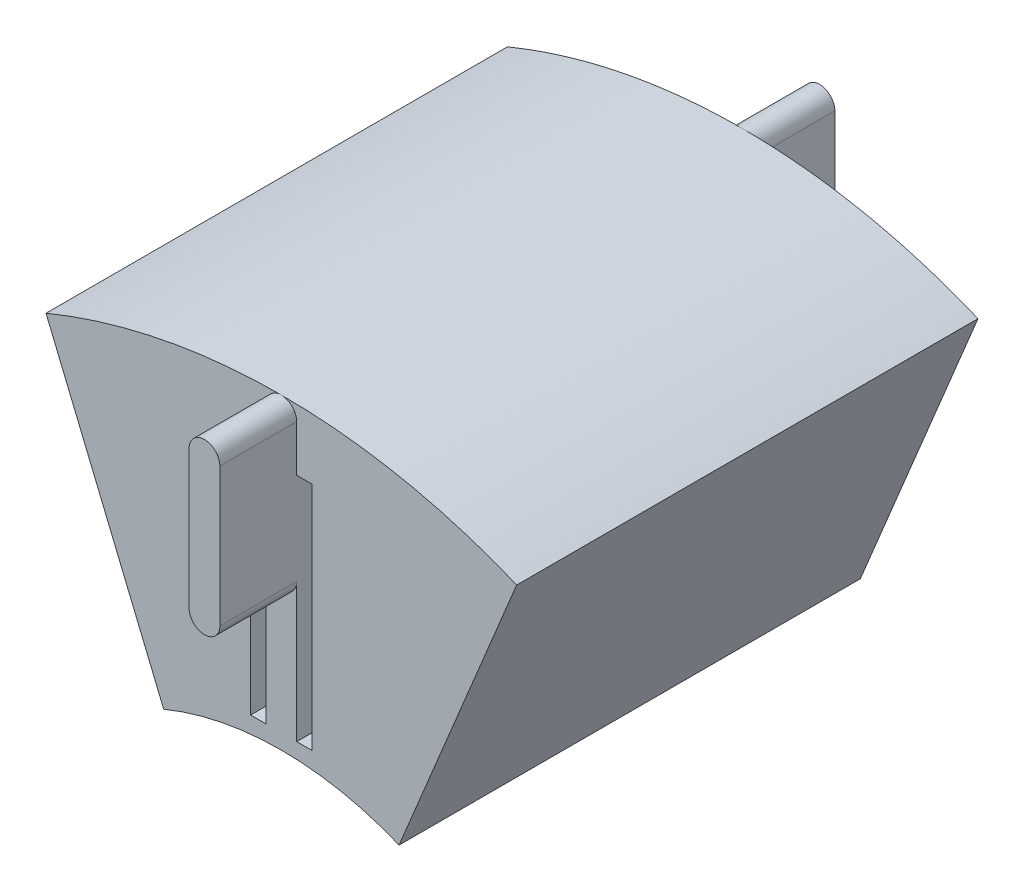
from build123d import *

# Parameters (mm, degrees)
BOSS_EXTRUDE1_DEPTH     = 3
BOSS_EXTRUDE2_DEPTH     = 0.5
BOSS_EXTRUDE3_START     = 0.5
BOSS_EXTRUDE3_DEPTH     = 0.5
CUT_EXTRUDE2_DEPTH      = 0.1
CUT_EXTRUDE2_DEPTH_BACK = 0.3
SKETCH9_W               = 0.2
SKETCH9_H               = 1.5
BOSS_EXTRUDE5_DEPTH     = 3


with BuildPart() as part:
    # Sketch1 → Boss-Extrude1 (new body)
    with BuildSketch(Plane.XY):
        with BuildLine():
            Line((-1.530733729, 3.69551813), (-0.765366865, 1.847759065))
            ThreePointArc((-0.765366865, 1.847759065), (0, 2), (0.765366865, 1.847759065))
            Line((0.765366865, 1.847759065), (1.530733729, 3.69551813))
            ThreePointArc((1.530733729, 3.69551813), (0, 4), (-1.530733729, 3.69551813))
        make_face()
    extrude(amount=BOSS_EXTRUDE1_DEPTH)

    # Sketch2 → Boss-Extrude2 (add)
    with BuildSketch(Plane.XY.offset(3)):
        with BuildLine():
            Line((-0.1, 3), (-0.1, 3.9))
            ThreePointArc((-0.1, 3.9), (0, 4), (0.1, 3.9))
            Line((0.1, 3.9), (0.1, 3))
            ThreePointArc((0.1, 3), (0, 2.9), (-0.1, 3))
        make_face()
    extrude(amount=BOSS_EXTRUDE2_DEPTH)

    # Sketch3 → Boss-Extrude3 (add)
    with BuildSketch(Plane(origin=(0, 0, 0), x_dir=(-1, 0, 0), z_dir=(0, 0, -1)).offset(BOSS_EXTRUDE3_START)):
        with BuildLine():
            Line((-0.1, 3), (-0.1, 3.9))
            ThreePointArc((-0.1, 3.9), (0, 4), (0.1, 3.9))
            Line((0.1, 3.9), (0.1, 3))
            ThreePointArc((0.1, 3), (0, 2.9), (-0.1, 3))
        make_face()
    extrude(amount=-BOSS_EXTRUDE3_DEPTH)

    # Sketch5 → Cut-Extrude2 (cut, two sides: drawn at the far end of the back side and taken through both)
    with BuildSketch(Plane(origin=(0.1, 0, 0), x_dir=(0, 0, -1), z_dir=(1, 0, 0)).offset(-CUT_EXTRUDE2_DEPTH_BACK)):
        Polygon((-3, 3.597759065), (-3, 2.097759065), (-1, 2.097759065), align=None)
    extrude(amount=CUT_EXTRUDE2_DEPTH + CUT_EXTRUDE2_DEPTH_BACK, mode=Mode.SUBTRACT)

    # Sketch9 → Boss-Extrude5 (add)
    with BuildSketch(Plane.XY.offset(3)):
        with Locations((0, 2.847759065)):
            Rectangle(SKETCH9_W, SKETCH9_H)
    extrude(amount=-BOSS_EXTRUDE5_DEPTH)


solid = part.part
